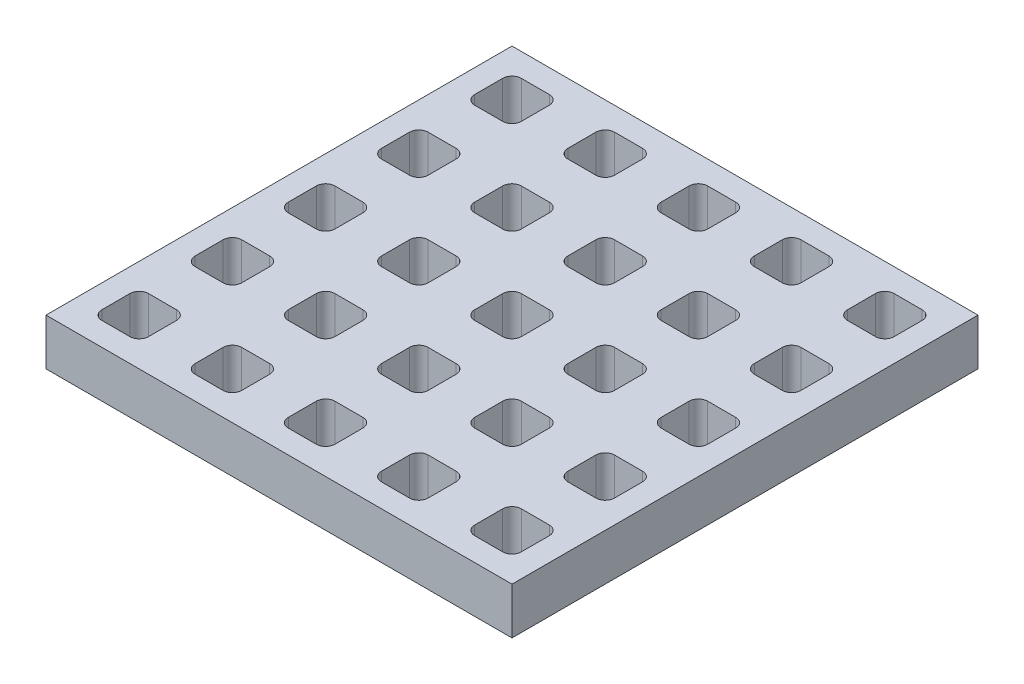
from build123d import *

# Parameters (mm, degrees)
CROQUIS1_W              = 100
CROQUIS1_H              = 100
SALIENTE_EXTRUIR1_DEPTH = 10
CROQUIS2_W              = 10
CROQUIS2_H              = 10
CORTAR_EXTRUIR1_DEPTH   = 72.414284285
REDONDEO1_R             = 2
MATRIZL1_COUNT          = 5
MATRIZL1_PITCH          = 20
MATRIZL1_COUNT_DIR2     = 5
MATRIZL1_PITCH_DIR2     = 20
REDONDEO1_OF_MATRIZL1_R = 2


with BuildPart() as part:
    # Croquis1 → Saliente-Extruir1 (new body)
    with BuildSketch(Plane(origin=(0, 0, 0), x_dir=(1, 0, 0), z_dir=(0, 1, 0))):
        Rectangle(CROQUIS1_W, CROQUIS1_H)
    extrude(amount=SALIENTE_EXTRUIR1_DEPTH)

    # Croquis2 → Cortar-Extruir1 (cut, through all)
    with BuildSketch(Plane(origin=(0, 10, 0), x_dir=(1, 0, 0), z_dir=(0, 1, 0))):
        with Locations((-40, 40)):
            Rectangle(CROQUIS2_W, CROQUIS2_H)
    cortar_extruir1 = extrude(amount=-CORTAR_EXTRUIR1_DEPTH, mode=Mode.SUBTRACT)

    # Redondeo1
    redondeo1_edges = [part.edges().sort_by_distance(p)[0] for p in [
        (-45, 5, -35),
        (-45, 5, -45),
        (-35, 5, -45),
        (-35, 5, -35),
    ]]
    fillet(redondeo1_edges, radius=REDONDEO1_R)

    # MatrizL1: Cortar-Extruir1 5 × 5
    with Locations(*[(i * MATRIZL1_PITCH, 0, j * MATRIZL1_PITCH_DIR2) for i in range(MATRIZL1_COUNT) for j in range(MATRIZL1_COUNT_DIR2) if (i, j) != (0, 0)]):
        add(cortar_extruir1, mode=Mode.SUBTRACT)

    # Redondeo1 of MatrizL1
    redondeo1_of_matrizl1_edges = [part.edges().sort_by_distance(p)[0] for p in [
        (-45, 5, -15),
        (-45, 5, -25),
        (-35, 5, -25),
        (-35, 5, -15),
        (-45, 5, 5),
        (-45, 5, -5),
        (-35, 5, -5),
        (-35, 5, 5),
        (-45, 5, 25),
        (-45, 5, 15),
        (-35, 5, 15),
        (-35, 5, 25),
        (-45, 5, 45),
        (-45, 5, 35),
        (-35, 5, 35),
        (-35, 5, 45),
        (-25, 5, -35),
        (-25, 5, -45),
        (-15, 5, -45),
        (-15, 5, -35),
        (-25, 5, -15),
        (-25, 5, -25),
        (-15, 5, -25),
        (-15, 5, -15),
        (-25, 5, 5),
        (-25, 5, -5),
        (-15, 5, -5),
        (-15, 5, 5),
        (-25, 5, 25),
        (-25, 5, 15),
        (-15, 5, 15),
        (-15, 5, 25),
        (-25, 5, 45),
        (-25, 5, 35),
        (-15, 5, 35),
        (-15, 5, 45),
        (-5, 5, -35),
        (-5, 5, -45),
        (5, 5, -45),
        (5, 5, -35),
        (-5, 5, -15),
        (-5, 5, -25),
        (5, 5, -25),
        (5, 5, -15),
        (-5, 5, 5),
        (-5, 5, -5),
        (5, 5, -5),
        (5, 5, 5),
        (-5, 5, 25),
        (-5, 5, 15),
        (5, 5, 15),
        (5, 5, 25),
        (-5, 5, 45),
        (-5, 5, 35),
        (5, 5, 35),
        (5, 5, 45),
        (15, 5, -35),
        (15, 5, -45),
        (25, 5, -45),
        (25, 5, -35),
        (15, 5, -15),
        (15, 5, -25),
        (25, 5, -25),
        (25, 5, -15),
        (15, 5, 5),
        (15, 5, -5),
        (25, 5, -5),
        (25, 5, 5),
        (15, 5, 25),
        (15, 5, 15),
        (25, 5, 15),
        (25, 5, 25),
        (15, 5, 45),
        (15, 5, 35),
        (25, 5, 35),
        (25, 5, 45),
        (35, 5, -35),
        (35, 5, -45),
        (45, 5, -45),
        (45, 5, -35),
        (35, 5, -15),
        (35, 5, -25),
        (45, 5, -25),
        (45, 5, -15),
        (35, 5, 5),
        (35, 5, -5),
        (45, 5, -5),
        (45, 5, 5),
        (35, 5, 25),
        (35, 5, 15),
        (45, 5, 15),
        (45, 5, 25),
        (35, 5, 45),
        (35, 5, 35),
        (45, 5, 35),
        (45, 5, 45),
    ]]
    fillet(redondeo1_of_matrizl1_edges, radius=REDONDEO1_OF_MATRIZL1_R)


solid = part.part
